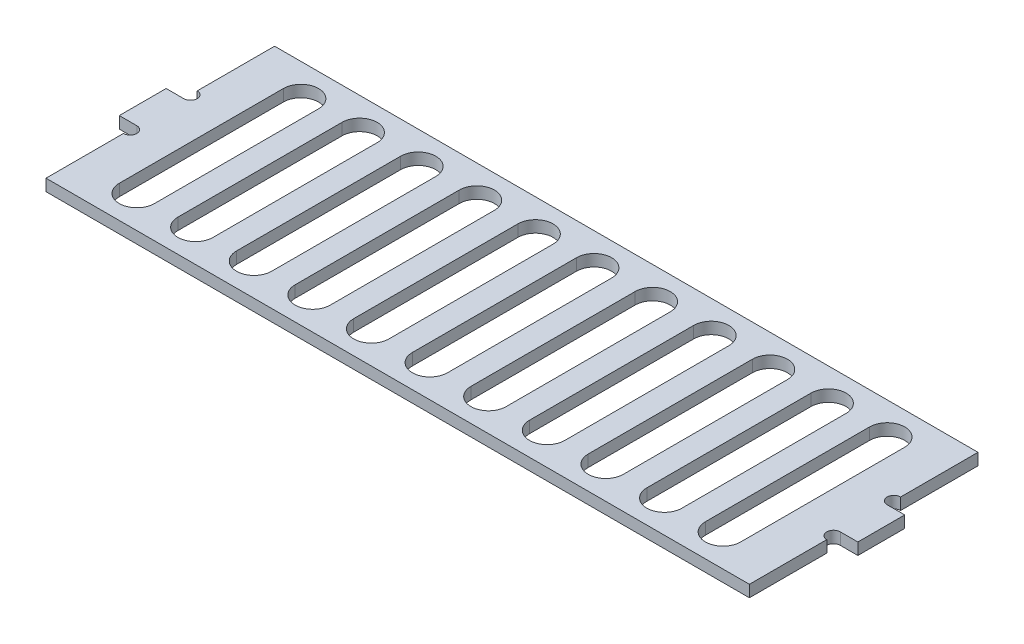
from build123d import *

# Parameters (mm, degrees)
SKETCH_1_W                 = 120
SKETCH_1_H                 = 39
EXTRUDE_1_DEPTH            = 2
SKETCH_2_W                 = 8
SKETCH_2_H                 = 2
EXTRUDE_2_DEPTH            = 3
SKETCH_3_R                 = 1.15
CUT_EXTRUDE_1_DEPTH        = 66.979163378
CUT_EXTRUDE_2_DEPTH        = 66.979163378
PATTERN_LINEAR_1_COUNT     = 6
PATTERN_LINEAR_1_PITCH     = 10
PATTERN_LINEAR_1_COL_COUNT = 6
PATTERN_LINEAR_1_COL_PITCH = 10


with BuildPart() as part:
    # 草图1 → 凸台-拉伸1 (new body)
    with BuildSketch(Plane(origin=(0, 0, 0), x_dir=(1, 0, 0), z_dir=(0, 1, 0))):
        Rectangle(SKETCH_1_W, SKETCH_1_H)
    extrude(amount=EXTRUDE_1_DEPTH)

    # 草图2 → 凸台-拉伸2 (add)
    with BuildSketch(Plane.ZY.offset(60)):
        with Locations((0, 1)):
            Rectangle(SKETCH_2_W, SKETCH_2_H)
    extrude_2 = extrude(amount=EXTRUDE_2_DEPTH)

    # 草图3 → 切除-拉伸1 (cut, through all)
    with BuildSketch(Plane(origin=(0, 2, 0), x_dir=(1, 0, 0), z_dir=(0, 1, 0))):
        with Locations((-60, 5.15)):
            Circle(SKETCH_3_R)
        with Locations((-60, -5.15)):
            Circle(SKETCH_3_R)
    cut_extrude_1 = extrude(amount=-CUT_EXTRUDE_1_DEPTH, mode=Mode.SUBTRACT)

    # 镜向1: 凸台-拉伸2, 切除-拉伸1 across plane
    add(extrude_2.mirror(Plane(origin=(0, 0, 0), x_dir=(0, 0, 1), z_dir=(1, 0, 0))))
    add(cut_extrude_1.mirror(Plane(origin=(0, 0, 0), x_dir=(0, 0, 1), z_dir=(1, 0, 0))), mode=Mode.SUBTRACT)

    # 草图4 → 切除-拉伸2 (cut, through all)
    with BuildSketch(Plane(origin=(0, 2, 0), x_dir=(1, 0, 0), z_dir=(0, 1, 0))):
        with BuildLine():
            ThreePointArc((-3, -14), (0, -11), (3, -14))
            Line((3, -14), (3, 14))
            ThreePointArc((3, 14), (0, 11), (-3, 14))
            Line((-3, 14), (-3, -14))
        make_face()
        with BuildLine():
            ThreePointArc((-3, 14), (0, 11), (3, 14))
            Line((3, 14), (-3, 14))
        make_face()
        with BuildLine():
            Line((-3, 14), (3, 14))
            ThreePointArc((3, 14), (0, 17), (-3, 14))
        make_face()
        with BuildLine():
            ThreePointArc((-3, -14), (0, -17), (3, -14))
            Line((3, -14), (-3, -14))
        make_face()
        with BuildLine():
            Line((-3, -14), (3, -14))
            ThreePointArc((3, -14), (0, -11), (-3, -14))
        make_face()
    cut_extrude_2 = extrude(amount=-CUT_EXTRUDE_2_DEPTH, mode=Mode.SUBTRACT)

    # 阵列(线性)1: 切除-拉伸2 ×6
    with Locations(*[(-i * PATTERN_LINEAR_1_PITCH, 0, 0) for i in range(1, PATTERN_LINEAR_1_COUNT)]):
        add(cut_extrude_2, mode=Mode.SUBTRACT)

    # 阵列(线性)1 col: 切除-拉伸2 ×6
    with Locations(*[(i * PATTERN_LINEAR_1_COL_PITCH, 0, 0) for i in range(1, PATTERN_LINEAR_1_COL_COUNT)]):
        add(cut_extrude_2, mode=Mode.SUBTRACT)


solid = part.part
